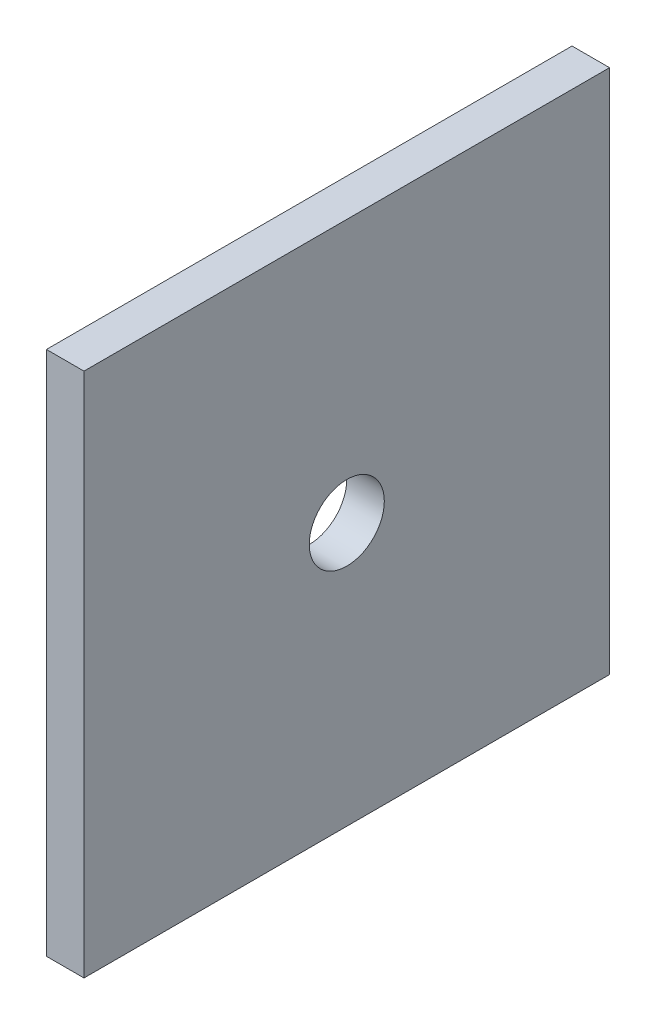
from build123d import *

# Parameters (mm, degrees)
SKETCH1_W           = 70
SKETCH1_H           = 70
SKETCH1_R           = 5
BOSS_EXTRUDE1_DEPTH = 5


with BuildPart() as part:
    # Sketch1 → Boss-Extrude1 (new body)
    with BuildSketch(Plane(origin=(0, 0, 0), x_dir=(0, 0, -1), z_dir=(1, 0, 0))):
        Rectangle(SKETCH1_W, SKETCH1_H)
        Circle(SKETCH1_R, mode=Mode.SUBTRACT)
    extrude(amount=BOSS_EXTRUDE1_DEPTH)


solid = part.part
